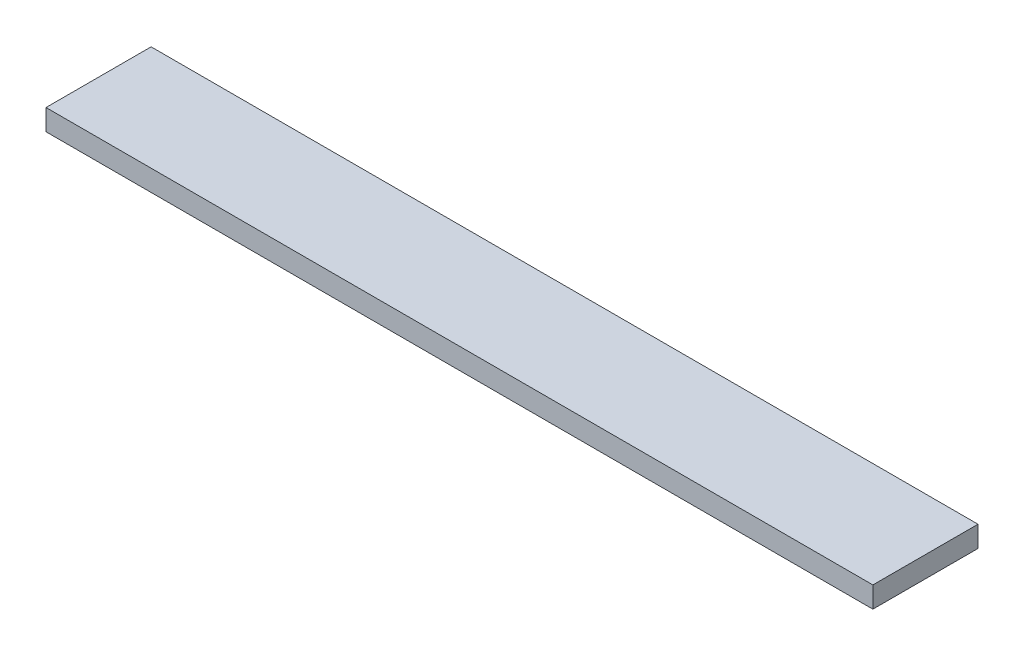
from build123d import *

# Parameters (mm, degrees)
ESQUISSE1_W        = 1180
ESQUISSE1_H        = 30
BOSS_EXTRU_1_DEPTH = 150


with BuildPart() as part:
    # Esquisse1 → Boss.-Extru.1 (new body)
    with BuildSketch(Plane.XY):
        with Locations((590, 15)):
            Rectangle(ESQUISSE1_W, ESQUISSE1_H)
    extrude(amount=BOSS_EXTRU_1_DEPTH)


solid = part.part
